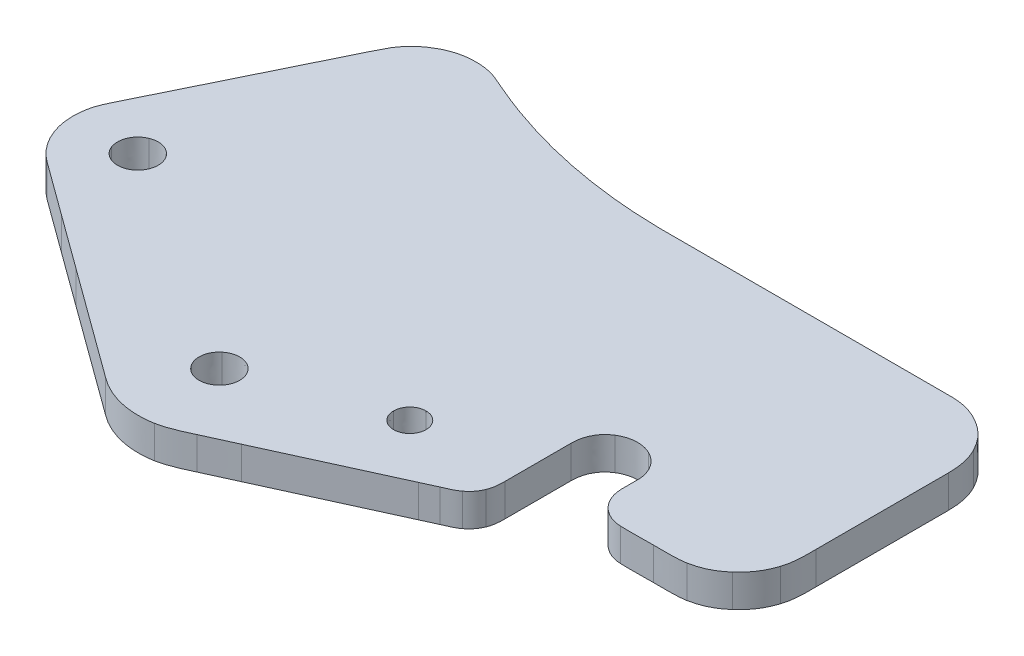
from build123d import *

# Parameters (mm, degrees)
BOSS_EXTRUDE1_DEPTH = 6.35


with BuildPart() as part:
    # Imported Profile → Boss-Extrude1 (new body)
    with BuildSketch(Plane(origin=(0, 0, 0), x_dir=(1, 0, 0), z_dir=(0, 1, 0))):
        with BuildLine():
            add(Edge.make_bspline(
                [(47.6487744, 3.4752534), (40.59301, 8.6201504), (33.5374742, 13.7602468), (26.4818876, 18.9072012)],
                knots=[0, 0, 0, 0, 1, 1, 1, 1], degree=3))
            add(Edge.make_bspline(
                [(26.4818876, 18.9072012), (22.9609904, 21.4772494), (19.4332098, 24.0472976), (15.9054292, 26.6173458)],
                knots=[0, 0, 0, 0, 1, 1, 1, 1], degree=3))
            add(Edge.make_bspline(
                [(15.9054292, 26.6173458), (12.3776486, 29.194252), (8.8292178, 31.722949), (5.3289962, 34.3343484)],
                knots=[0, 0, 0, 0, 1, 1, 1, 1], degree=3))
            add(Edge.make_bspline(
                [(5.3289962, 34.3343484), (1.725422, 37.0214906), (-0.1831594, 41.396793), (0.2922778, 45.8616304)],
                knots=[0, 0, 0, 0, 1, 1, 1, 1], degree=3))
            add(Edge.make_bspline(
                [(0.2922778, 45.8616304), (0.5678678, 48.4454454), (1.3533628, 49.775237), (2.4489156, 52.0214352)],
                knots=[0, 0, 0, 0, 1, 1, 1, 1], degree=3))
            add(Edge.make_bspline(
                [(2.4489156, 52.0214352), (3.406648, 53.9851346), (4.3712638, 55.9420014), (5.3289962, 57.898792)],
                knots=[0, 0, 0, 0, 1, 1, 1, 1], degree=3))
            add(Edge.make_bspline(
                [(5.3289962, 57.898792), (9.1599258, 65.7398482), (12.9977896, 73.5809044), (16.8287192, 81.4287932)],
                knots=[0, 0, 0, 0, 1, 1, 1, 1], degree=3))
            add(Edge.make_bspline(
                [(16.8287192, 81.4287932), (17.2627798, 82.3038486), (19.17827, 86.3001322), (19.7019418, 87.1338872)],
                knots=[0, 0, 0, 0, 1, 1, 1, 1], degree=3))
            add(Edge.make_bspline(
                [(19.7019418, 87.1338872), (20.9490564, 89.1182368), (22.464903, 90.5238474), (24.531955, 91.6194002)],
                knots=[0, 0, 0, 0, 1, 1, 1, 1], degree=3))
            add(Edge.make_bspline(
                [(24.531955, 91.6194002), (26.6885928, 92.7563042), (28.769437, 93.2041316), (31.2085736, 93.0594532)],
                knots=[0, 0, 0, 0, 1, 1, 1, 1], degree=3))
            add(Edge.make_bspline(
                [(31.2085736, 93.0594532), (33.8061554, 92.9079422), (34.9912686, 92.2394904), (37.2925594, 91.2472902)],
                knots=[0, 0, 0, 0, 1, 1, 1, 1], degree=3))
            add(Edge.make_bspline(
                [(37.2925594, 91.2472902), (45.3403208, 87.7540028), (53.505227, 85.3975432), (62.179962, 84.0608428)],
                knots=[0, 0, 0, 0, 1, 1, 1, 1], degree=3))
            add(Edge.make_bspline(
                [(62.179962, 84.0608428), (71.9502752, 82.5518796), (78.5372572, 82.8688462), (88.3282714, 82.8688462)],
                knots=[0, 0, 0, 0, 1, 1, 1, 1], degree=3))
            add(Edge.make_bspline(
                [(88.3282714, 82.8688462), (97.0650078, 82.8688462), (105.8017696, 82.8688462), (114.5316734, 82.8688462)],
                knots=[0, 0, 0, 0, 1, 1, 1, 1], degree=3))
            add(Edge.make_bspline(
                [(114.5316734, 82.8688462), (118.8517562, 82.8688462), (123.1719152, 82.8688462), (127.4989576, 82.8688462)],
                knots=[0, 0, 0, 0, 1, 1, 1, 1], degree=3))
            add(Edge.make_bspline(
                [(127.4989576, 82.8688462), (129.648712, 82.8688462), (131.7984664, 82.9378326), (133.941312, 82.8638424)],
                knots=[0, 0, 0, 0, 1, 1, 1, 1], degree=3))
            add(Edge.make_bspline(
                [(133.941312, 82.8638424), (136.2426282, 82.7813432), (138.1925608, 82.1885834), (140.1493768, 80.9758858)],
                knots=[0, 0, 0, 0, 1, 1, 1, 1], degree=3))
            add(Edge.make_bspline(
                [(140.1493768, 80.9758858), (142.2439624, 79.6874454), (143.6978076, 78.1095974), (144.8071272, 75.9116338)],
                knots=[0, 0, 0, 0, 1, 1, 1, 1], degree=3))
            add(Edge.make_bspline(
                [(144.8071272, 75.9116338), (145.8337698, 73.892791), (146.17827, 71.8946492), (146.17827, 69.669152)],
                knots=[0, 0, 0, 0, 1, 1, 1, 1], degree=3))
            add(Edge.make_bspline(
                [(146.17827, 69.669152), (146.17827, 65.3489422), (146.17827, 61.0219506), (146.17827, 56.7017408)],
                knots=[0, 0, 0, 0, 1, 1, 1, 1], degree=3))
            add(Edge.make_bspline(
                [(146.17827, 56.7017408), (146.17827, 52.3953994), (146.17827, 48.0890326), (146.17827, 43.7826912)],
                knots=[0, 0, 0, 0, 1, 1, 1, 1], degree=3))
            add(Edge.make_bspline(
                [(146.17827, 43.7826912), (146.17827, 41.653587), (146.2542668, 39.586535), (145.5788046, 37.4850406)],
                knots=[0, 0, 0, 0, 1, 1, 1, 1], degree=3))
            add(Edge.make_bspline(
                [(145.5788046, 37.4850406), (144.8415696, 35.176841), (143.6909242, 33.4060546), (141.8650198, 31.8006476)],
                knots=[0, 0, 0, 0, 1, 1, 1, 1], degree=3))
            add(Edge.make_bspline(
                [(141.8650198, 31.8006476), (140.0804666, 30.2296322), (138.2063276, 29.313251), (135.8636602, 28.8653982)],
                knots=[0, 0, 0, 0, 1, 1, 1, 1], degree=3))
            add(Edge.make_bspline(
                [(135.8636602, 28.8653982), (134.2513698, 28.5624016), (131.137025, 28.6449008), (129.5247092, 28.6449008)],
                knots=[0, 0, 0, 0, 1, 1, 1, 1], degree=3))
            add(Edge.make_bspline(
                [(129.5247092, 28.6449008), (127.3818128, 28.6449008), (125.2321092, 28.5624016), (123.0892636, 28.6449008)],
                knots=[0, 0, 0, 0, 1, 1, 1, 1], degree=3))
            add(Edge.make_bspline(
                [(123.0892636, 28.6449008), (120.787922, 28.734385), (118.7139612, 30.0573948), (117.6735772, 32.11068)],
                knots=[0, 0, 0, 0, 1, 1, 1, 1], degree=3))
            add(Edge.make_bspline(
                [(117.6735772, 32.11068), (116.5849078, 34.23285), (117.0741118, 36.3136942), (116.9707592, 38.4427476)],
                knots=[0, 0, 0, 0, 1, 1, 1, 1], degree=3))
            add(Edge.make_bspline(
                [(116.9707592, 38.4427476), (116.8537668, 40.750998), (115.5031726, 42.8042324), (113.4292118, 43.8239916)],
                knots=[0, 0, 0, 0, 1, 1, 1, 1], degree=3))
            add(Edge.make_bspline(
                [(113.4292118, 43.8239916), (111.4448114, 44.8023996), (109.1021694, 44.671488), (107.2349138, 43.4934868)],
                knots=[0, 0, 0, 0, 1, 1, 1, 1], degree=3))
            add(Edge.make_bspline(
                [(107.2349138, 43.4934868), (105.188512, 42.1981376), (104.2790142, 40.1655026), (104.2790142, 37.8228352)],
                knots=[0, 0, 0, 0, 1, 1, 1, 1], degree=3))
            add(Edge.make_bspline(
                [(104.2790142, 37.8228352), (104.2790142, 33.509585), (104.2790142, 29.1963348), (104.2790142, 24.8762012)],
                knots=[0, 0, 0, 0, 1, 1, 1, 1], degree=3))
            add(Edge.make_bspline(
                [(104.2790142, 24.8762012), (104.2790142, 23.7806484), (104.2240232, 22.747097), (103.7900134, 21.6998042)],
                knots=[0, 0, 0, 0, 1, 1, 1, 1], degree=3))
            add(Edge.make_bspline(
                [(103.7900134, 21.6998042), (103.3350232, 20.6180436), (102.7013694, 19.7980808), (101.7643126, 19.0884302)],
                knots=[0, 0, 0, 0, 1, 1, 1, 1], degree=3))
            add(Edge.make_bspline(
                [(101.7643126, 19.0884302), (100.8823738, 18.42008), (99.8833156, 18.0617876), (98.9048568, 17.6207928)],
                knots=[0, 0, 0, 0, 1, 1, 1, 1], degree=3))
            add(Edge.make_bspline(
                [(98.9048568, 17.6207928), (97.9264742, 17.1727876), (96.9480662, 16.7250872), (95.9627748, 16.2772344)],
                knots=[0, 0, 0, 0, 1, 1, 1, 1], degree=3))
            add(Edge.make_bspline(
                [(95.9627748, 16.2772344), (88.0459758, 12.6667514), (80.129126, 9.0562938), (72.2053674, 5.4458362)],
                knots=[0, 0, 0, 0, 1, 1, 1, 1], degree=3))
            add(Edge.make_bspline(
                [(72.2053674, 5.4458362), (70.2279266, 4.5501306), (68.2504096, 3.6474908), (66.272918, 2.7449018)],
                knots=[0, 0, 0, 0, 1, 1, 1, 1], degree=3))
            add(Edge.make_bspline(
                [(66.272918, 2.7449018), (64.2954772, 1.8422874), (62.3868704, 0.8983472), (60.2026736, 0.4917948)],
                knots=[0, 0, 0, 0, 1, 1, 1, 1], degree=3))
            add(Edge.make_bspline(
                [(60.2026736, 0.4917948), (55.779162, -0.3350006), (51.2247642, 0.7467854), (47.6487744, 3.4752534)],
                knots=[0, 0, 0, 0, 1, 1, 1, 1], degree=3))
        make_face()
        with BuildLine():
            add(Edge.make_bspline(
                [(87.8114576, 25.9559044), (87.8114576, 27.7059898), (86.3921056, 29.1253418), (84.6351114, 29.1253418)],
                knots=[0, 0, 0, 0, 1, 1, 1, 1], degree=3))
            add(Edge.make_bspline(
                [(84.6351114, 29.1253418), (82.8781172, 29.1253418), (81.4587144, 27.7059898), (81.4587144, 25.9559044)],
                knots=[0, 0, 0, 0, 1, 1, 1, 1], degree=3))
            add(Edge.make_bspline(
                [(81.4587144, 25.9559044), (81.4587144, 24.198834), (82.8781172, 22.779482), (84.6351114, 22.779482)],
                knots=[0, 0, 0, 0, 1, 1, 1, 1], degree=3))
            add(Edge.make_bspline(
                [(84.6351114, 22.779482), (86.3921056, 22.779482), (87.8114576, 24.198834), (87.8114576, 25.9559044)],
                knots=[0, 0, 0, 0, 1, 1, 1, 1], degree=3))
        make_face(mode=Mode.SUBTRACT)
        with BuildLine():
            add(Edge.make_bspline(
                [(16.5875716, 46.0338932), (15.7469586, 48.059594), (13.4249668, 49.0242352), (11.399266, 48.1836476)],
                knots=[0, 0, 0, 0, 1, 1, 1, 1], degree=3))
            add(Edge.make_bspline(
                [(11.399266, 48.1836476), (9.3735398, 47.3430346), (8.4158074, 45.0210428), (9.249537, 42.9952912)],
                knots=[0, 0, 0, 0, 1, 1, 1, 1], degree=3))
            add(Edge.make_bspline(
                [(9.249537, 42.9952912), (10.0901246, 40.9695904), (12.4121164, 40.0118326), (14.4378172, 40.8455368)],
                knots=[0, 0, 0, 0, 1, 1, 1, 1], degree=3))
            add(Edge.make_bspline(
                [(14.4378172, 40.8455368), (16.4635434, 41.6862006), (17.4212758, 44.0081416), (16.5875716, 46.0338932)],
                knots=[0, 0, 0, 0, 1, 1, 1, 1], degree=3))
        make_face(mode=Mode.SUBTRACT)
        with BuildLine():
            add(Edge.make_bspline(
                [(60.3200216, 18.6384946), (58.9140046, 20.3196952), (56.4128666, 20.5401926), (54.731666, 19.1274954)],
                knots=[0, 0, 0, 0, 1, 1, 1, 1], degree=3))
            add(Edge.make_bspline(
                [(54.731666, 19.1274954), (53.0504654, 17.7218848), (52.829968, 15.2207468), (54.2426652, 13.5395462)],
                knots=[0, 0, 0, 0, 1, 1, 1, 1], degree=3))
            add(Edge.make_bspline(
                [(54.2426652, 13.5395462), (55.6551592, 11.8583456), (58.1563226, 11.6447316), (59.8375232, 13.0505454)],
                knots=[0, 0, 0, 0, 1, 1, 1, 1], degree=3))
            add(Edge.make_bspline(
                [(59.8375232, 13.0505454), (61.511815, 14.4561306), (61.7323124, 16.964152), (60.3200216, 18.6384946)],
                knots=[0, 0, 0, 0, 1, 1, 1, 1], degree=3))
        make_face(mode=Mode.SUBTRACT)
    extrude(amount=BOSS_EXTRUDE1_DEPTH)


solid = part.part
